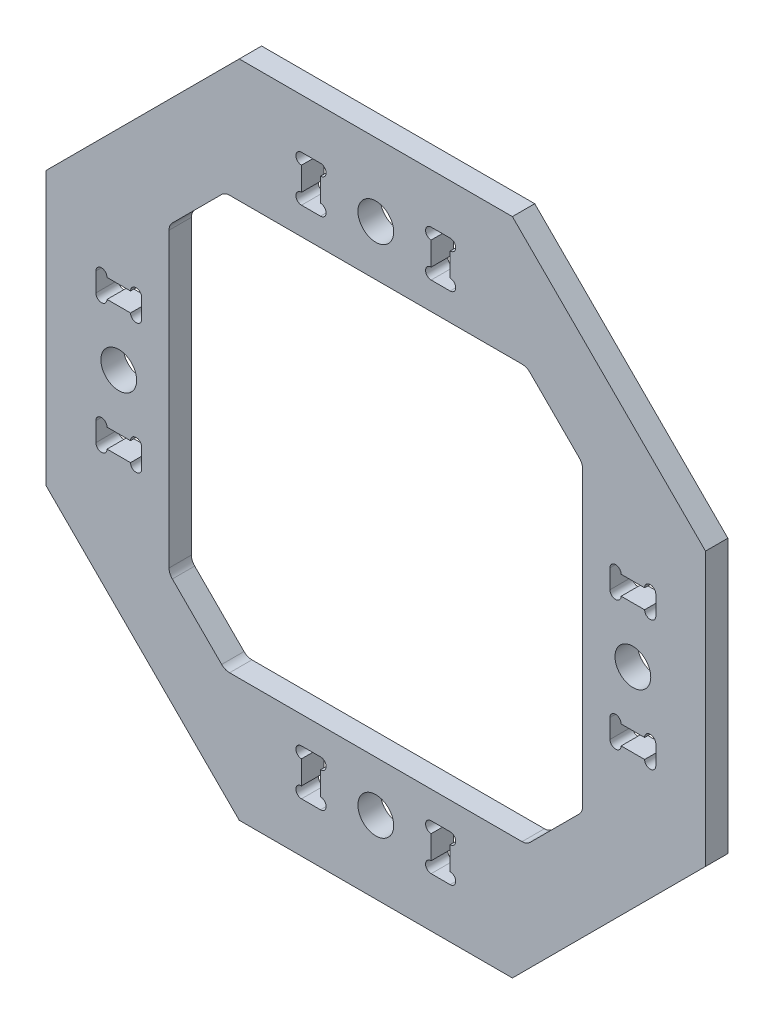
from build123d import *

# Parameters (mm, degrees)
SKETCH1_R           = 1.6
SKETCH1_W           = 4.1
SKETCH1_H           = 1.7
SKETCH1_W_2         = 1.7
SKETCH1_H_2         = 4.1
BOSS_EXTRUDE1_DEPTH = 2
CUT_EXTRUDE1_REACH  = 43.767
FILLET2_R           = 1
SKETCH4_R           = 0.5
CUT_EXTRUDE3_DEPTH  = 2


with BuildPart() as part:
    # Sketch1 → Boss-Extrude1 (new body)
    with BuildSketch(Plane.XY):
        Polygon((29.5, 12.21930009), (12.21930009, 29.5), (-12.21930009, 29.5), (-29.5, 12.21930009), (-29.5, -12.21930009), (-12.21930009, -29.5), (12.21930009, -29.5), (29.5, -12.21930009), align=None)
        with Locations((-23, 0)):
            Circle(SKETCH1_R, mode=Mode.SUBTRACT)
        with Locations((0, 23)):
            Circle(SKETCH1_R, mode=Mode.SUBTRACT)
        with Locations((23, 0)):
            Circle(SKETCH1_R, mode=Mode.SUBTRACT)
        with Locations((0, -23)):
            Circle(SKETCH1_R, mode=Mode.SUBTRACT)
        with Locations((-23, -5.8)):
            Rectangle(SKETCH1_W, SKETCH1_H, mode=Mode.SUBTRACT)
        with Locations((-5.8, 23)):
            Rectangle(SKETCH1_W_2, SKETCH1_H_2, mode=Mode.SUBTRACT)
        with Locations((-23, 5.8)):
            Rectangle(SKETCH1_W, SKETCH1_H, mode=Mode.SUBTRACT)
        with Locations((5.8, 23)):
            Rectangle(SKETCH1_W_2, SKETCH1_H_2, mode=Mode.SUBTRACT)
        with Locations((23, 5.8)):
            Rectangle(SKETCH1_W, SKETCH1_H, mode=Mode.SUBTRACT)
        with Locations((23, -5.8)):
            Rectangle(SKETCH1_W, SKETCH1_H, mode=Mode.SUBTRACT)
        with Locations((5.8, -23)):
            Rectangle(SKETCH1_W_2, SKETCH1_H_2, mode=Mode.SUBTRACT)
        with Locations((-5.8, -23)):
            Rectangle(SKETCH1_W_2, SKETCH1_H_2, mode=Mode.SUBTRACT)
    extrude(amount=-BOSS_EXTRUDE1_DEPTH)

    # Sketch2 → Cut-Extrude1 (cut, up to next)
    with BuildSketch(Plane(origin=(0, 0, 0), x_dir=(-1, 0, 0), z_dir=(0, 0, -1)), mode=Mode.PRIVATE) as cut_extrude1_sk1:
        Polygon((18.5, 13.5), (16, 16), (-16, -16), (-13.5, -18.5), (13.5, -18.5), (18.5, -13.5), align=None)
    cut_extrude1_tool1 = extrude(cut_extrude1_sk1.sketch, amount=CUT_EXTRUDE1_REACH, mode=Mode.PRIVATE) & part.part
    # Sketch2 → Cut-Extrude1 (cut, up to next)
    with BuildSketch(Plane(origin=(0, 0, 0), x_dir=(-1, 0, 0), z_dir=(0, 0, -1)), mode=Mode.PRIVATE) as cut_extrude1_sk2:
        Polygon((-16, -16), (16, 16), (13.5, 18.5), (-13.5, 18.5), (-18.5, 13.5), (-18.5, -13.5), align=None)
    cut_extrude1_tool2 = extrude(cut_extrude1_sk2.sketch, amount=CUT_EXTRUDE1_REACH, mode=Mode.PRIVATE) & part.part
    add(cut_extrude1_tool1.solids().sort_by_distance((-6.06558, -6.06558, 0))[0], mode=Mode.SUBTRACT)
    add(cut_extrude1_tool2.solids().sort_by_distance((6.06558, 6.06558, 0))[0], mode=Mode.SUBTRACT)

    # Fillet2
    fillet2_edges = [part.edges().sort_by_distance(p)[0] for p in [
        (18.5, -13.5, -1),
        (13.5, -18.5, -1),
        (-13.5, -18.5, -1),
        (-18.5, -13.5, -1),
        (-18.5, 13.5, -1),
        (-13.5, 18.5, -1),
        (13.5, 18.5, -1),
        (18.5, 13.5, -1),
    ]]
    fillet(fillet2_edges, radius=FILLET2_R)

    # Sketch4 → Cut-Extrude3 (cut)
    with BuildSketch(Plane.XY):
        with Locations((-24.55, 6.65)):
            Circle(SKETCH4_R)
        with Locations((-21.45, 6.65)):
            Circle(SKETCH4_R)
        with Locations((-21.45, 4.95)):
            Circle(SKETCH4_R)
        with Locations((-24.55, 4.95)):
            Circle(SKETCH4_R)
        with Locations((-24.55, -4.95)):
            Circle(SKETCH4_R)
        with Locations((-24.55, -6.65)):
            Circle(SKETCH4_R)
        with Locations((-21.45, -4.95)):
            Circle(SKETCH4_R)
        with Locations((-21.45, -6.65)):
            Circle(SKETCH4_R)
        with Locations((6.65, 21.45)):
            Circle(SKETCH4_R)
        with Locations((4.95, 21.45)):
            Circle(SKETCH4_R)
        with Locations((4.95, 24.55)):
            Circle(SKETCH4_R)
        with Locations((-4.95, 24.55)):
            Circle(SKETCH4_R)
        with Locations((-6.65, 24.55)):
            Circle(SKETCH4_R)
        with Locations((-4.95, 21.45)):
            Circle(SKETCH4_R)
        with Locations((-6.65, 21.45)):
            Circle(SKETCH4_R)
        with Locations((21.45, -6.65)):
            Circle(SKETCH4_R)
        with Locations((21.45, -4.95)):
            Circle(SKETCH4_R)
        with Locations((24.55, -4.95)):
            Circle(SKETCH4_R)
        with Locations((24.55, 4.95)):
            Circle(SKETCH4_R)
        with Locations((24.55, 6.65)):
            Circle(SKETCH4_R)
        with Locations((21.45, 4.95)):
            Circle(SKETCH4_R)
        with Locations((21.45, 6.65)):
            Circle(SKETCH4_R)
        with Locations((-6.65, -21.45)):
            Circle(SKETCH4_R)
        with Locations((-4.95, -21.45)):
            Circle(SKETCH4_R)
        with Locations((-4.95, -24.55)):
            Circle(SKETCH4_R)
        with Locations((4.95, -24.55)):
            Circle(SKETCH4_R)
        with Locations((6.65, -24.55)):
            Circle(SKETCH4_R)
        with Locations((4.95, -21.45)):
            Circle(SKETCH4_R)
        with Locations((6.65, -21.45)):
            Circle(SKETCH4_R)
        with Locations((6.65, 24.55)):
            Circle(SKETCH4_R)
        with Locations((24.55, -6.65)):
            Circle(SKETCH4_R)
        with Locations((-6.65, -24.55)):
            Circle(SKETCH4_R)
    extrude(amount=-CUT_EXTRUDE3_DEPTH, mode=Mode.SUBTRACT)


solid = part.part
